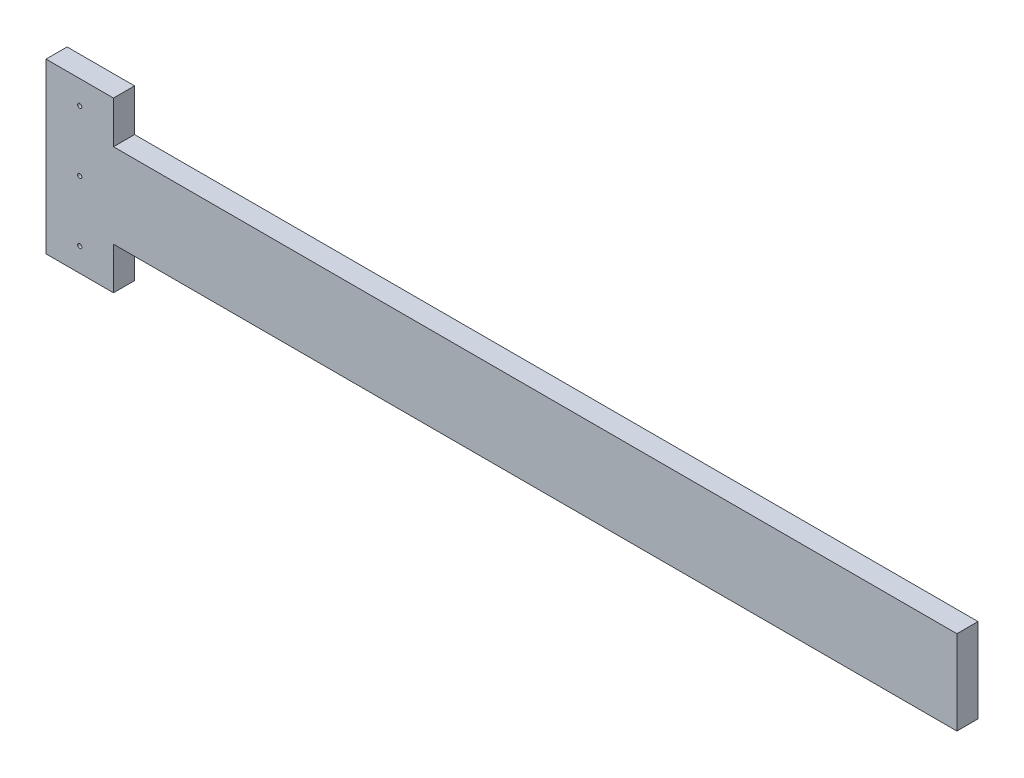
from build123d import *

# Parameters (mm, degrees)
BOSS_EXTRUDE1_DEPTH     = 6.35
CUT_EXTRUDE1_DEPTH      = 280.056311342
CUT_EXTRUDE1_DEPTH_BACK = 280.056311342
SKETCH2_R               = 0.635


with BuildPart() as part:
    # Sketch1 → Boss-Extrude1 (new body)
    with BuildSketch(Plane.XY):
        Polygon((0, 0), (20.32, 0), (20.32, 12.7), (274.32, 12.7), (274.32, 38.1), (20.32, 38.1), (20.32, 50.8), (0, 50.8), align=None)
    extrude(amount=BOSS_EXTRUDE1_DEPTH)

    # Sketch2 → Cut-Extrude1 (cut, two sides: drawn at the far end of the back side and taken through both)
    with BuildSketch(Plane.XY.offset(6.35).offset(-CUT_EXTRUDE1_DEPTH_BACK)):
        with Locations((10.16, 43.688)):
            Circle(SKETCH2_R)
        with Locations((10.16, 25.4)):
            Circle(SKETCH2_R)
        with Locations((10.16, 7.112)):
            Circle(SKETCH2_R)
    extrude(amount=CUT_EXTRUDE1_DEPTH + CUT_EXTRUDE1_DEPTH_BACK, mode=Mode.SUBTRACT)


solid = part.part
